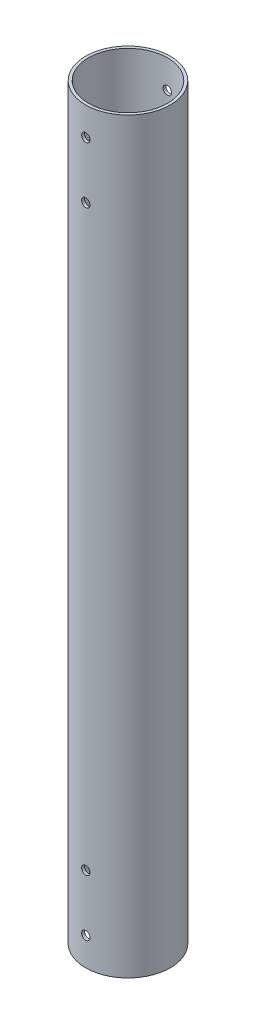
from build123d import *

# Parameters (mm, degrees)
SKETCH_1_R               = 15
EXTRUDE_1_DEPTH          = 265
CUT_EXTRUDE_1_DEPTH      = 266.847700761
CUT_EXTRUDE_1_DEPTH_BACK = 266.847700761
SKETCH_2_R               = 1.5
CUT_EXTRUDE_2_REACH      = 267.848
SKETCH_3_R               = 14


with BuildPart() as part:
    # 草圖1 → 填料-伸長1 (new body)
    with BuildSketch(Plane(origin=(0, 0, 0), x_dir=(1, 0, 0), z_dir=(0, 1, 0))):
        with Locations(Location((0, 0, 0), (0, 0, 270))):
            Circle(SKETCH_1_R)
    extrude(amount=EXTRUDE_1_DEPTH)

    # 草圖2 → 除料-伸長1 (cut, two sides: drawn at the far end of the back side and taken through both)
    with BuildSketch(Plane.XY.offset(-CUT_EXTRUDE_1_DEPTH_BACK)):
        with Locations((0, 255)):
            Circle(SKETCH_2_R)
        with Locations((0, 235)):
            Circle(SKETCH_2_R)
        with Locations((0, 10)):
            Circle(SKETCH_2_R)
        with Locations((0, 30)):
            Circle(SKETCH_2_R)
    extrude(amount=CUT_EXTRUDE_1_DEPTH + CUT_EXTRUDE_1_DEPTH_BACK, mode=Mode.SUBTRACT)

    # 草圖3 → 除料-伸長2 (cut, up to next)
    with BuildSketch(Plane(origin=(0, 265, 0), x_dir=(1, 0, 0), z_dir=(0, 1, 0)), mode=Mode.PRIVATE) as cut_extrude_2_sk1:
        with Locations(Location((0, 0, 0), (0, 0, 270))):
            Circle(SKETCH_3_R)
    cut_extrude_2_tool1 = extrude(cut_extrude_2_sk1.sketch, amount=-CUT_EXTRUDE_2_REACH, mode=Mode.PRIVATE) & part.part
    add(cut_extrude_2_tool1.solids().sort_by_distance((0, 265, 0))[0], mode=Mode.SUBTRACT)


solid = part.part
